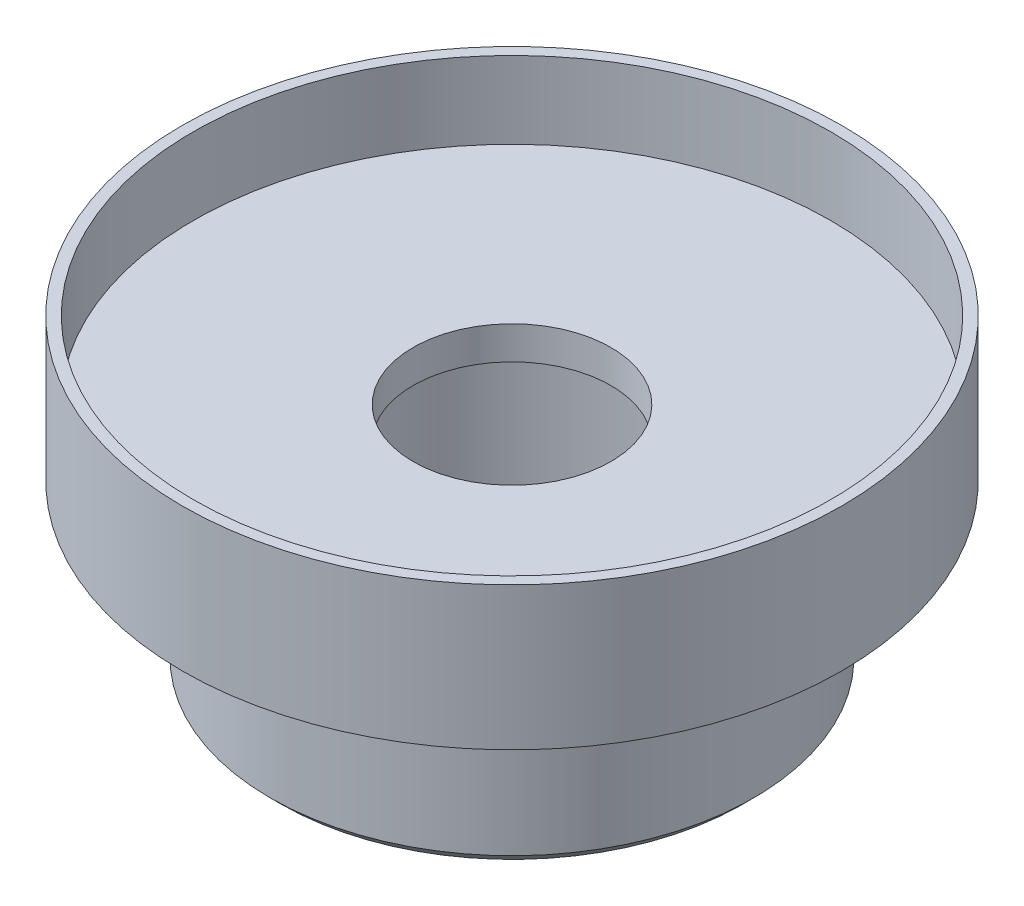
from build123d import *

# Parameters (mm, degrees)
ESQUISSE1_R             = 11
BOSS_EXTRU_1_DEPTH      = 7.5
ESQUISSE3_R             = 15
BOSS_EXTRU_2_DEPTH      = 6.5
CHANFREIN1_SIZE         = 0.5
CHANFREIN2_SIZE         = 1
ESQUISSE4_R             = 14.5
ENL_V_MAT_EXTRU_1_DEPTH = 3.5
ESQUISSE5_R             = 4.5
ENL_V_MAT_EXTRU_2_DEPTH = 1.5
ESQUISSE6_R             = 7
ENL_V_MAT_EXTRU_3_DEPTH = 1
ESQUISSE8_R             = 8
ENL_V_MAT_EXTRU_4_DEPTH = 23.671568098


with BuildPart() as part:
    # Esquisse1 → Boss.-Extru.1 (new body)
    with BuildSketch(Plane(origin=(0, 0, 0), x_dir=(1, 0, 0), z_dir=(0, 1, 0))):
        with Locations(Location((0, 0, 0), (0, 0, 270))):
            Circle(ESQUISSE1_R)
    extrude(amount=BOSS_EXTRU_1_DEPTH)

    # Esquisse3 → Boss.-Extru.2 (add)
    with BuildSketch(Plane(origin=(0, 7.5, 0), x_dir=(1, 0, 0), z_dir=(0, 1, 0))):
        with Locations(Location((0, 0, 0), (0, 0, 90))):
            Circle(ESQUISSE3_R)
    extrude(amount=BOSS_EXTRU_2_DEPTH)

    # Chanfrein1
    chanfrein1_edges = [part.edges().sort_by_distance(p)[0] for p in [
        (0, 0, -11),
    ]]
    chamfer(chanfrein1_edges, length=CHANFREIN1_SIZE)

    # Chanfrein2
    chanfrein2_edges = [part.edges().sort_by_distance(p)[0] for p in [
        (0, 7.5, -11),
    ]]
    chamfer(chanfrein2_edges, length=CHANFREIN2_SIZE)

    # Esquisse4 → Enlèv. mat.-Extru.1 (cut)
    with BuildSketch(Plane(origin=(0, 14, 0), x_dir=(1, 0, 0), z_dir=(0, 1, 0))):
        with Locations(Location((0, 0, 0), (0, 0, 270))):
            Circle(ESQUISSE4_R)
    extrude(amount=-ENL_V_MAT_EXTRU_1_DEPTH, mode=Mode.SUBTRACT)

    # Esquisse5 → Enlèv. mat.-Extru.2 (cut)
    with BuildSketch(Plane(origin=(0, 10.5, 0), x_dir=(1, 0, 0), z_dir=(0, 1, 0))):
        with Locations(Location((0, 0, 0), (0, 0, 270))):
            Circle(ESQUISSE5_R)
    extrude(amount=-ENL_V_MAT_EXTRU_2_DEPTH, mode=Mode.SUBTRACT)

    # Esquisse6 → Enlèv. mat.-Extru.3 (cut)
    with BuildSketch(Plane(origin=(0, 9, 0), x_dir=(1, 0, 0), z_dir=(0, 1, 0))):
        with Locations(Location((0, 0, 0), (0, 0, 270))):
            Circle(ESQUISSE6_R)
    extrude(amount=-ENL_V_MAT_EXTRU_3_DEPTH, mode=Mode.SUBTRACT)

    # Esquisse8 → Enlèv. mat.-Extru.4 (cut, through all)
    with BuildSketch(Plane(origin=(0, 8, 0), x_dir=(1, 0, 0), z_dir=(0, 1, 0))):
        with Locations(Location((0, 0, 0), (0, 0, 270))):
            Circle(ESQUISSE8_R)
    extrude(amount=-ENL_V_MAT_EXTRU_4_DEPTH, mode=Mode.SUBTRACT)


solid = part.part
